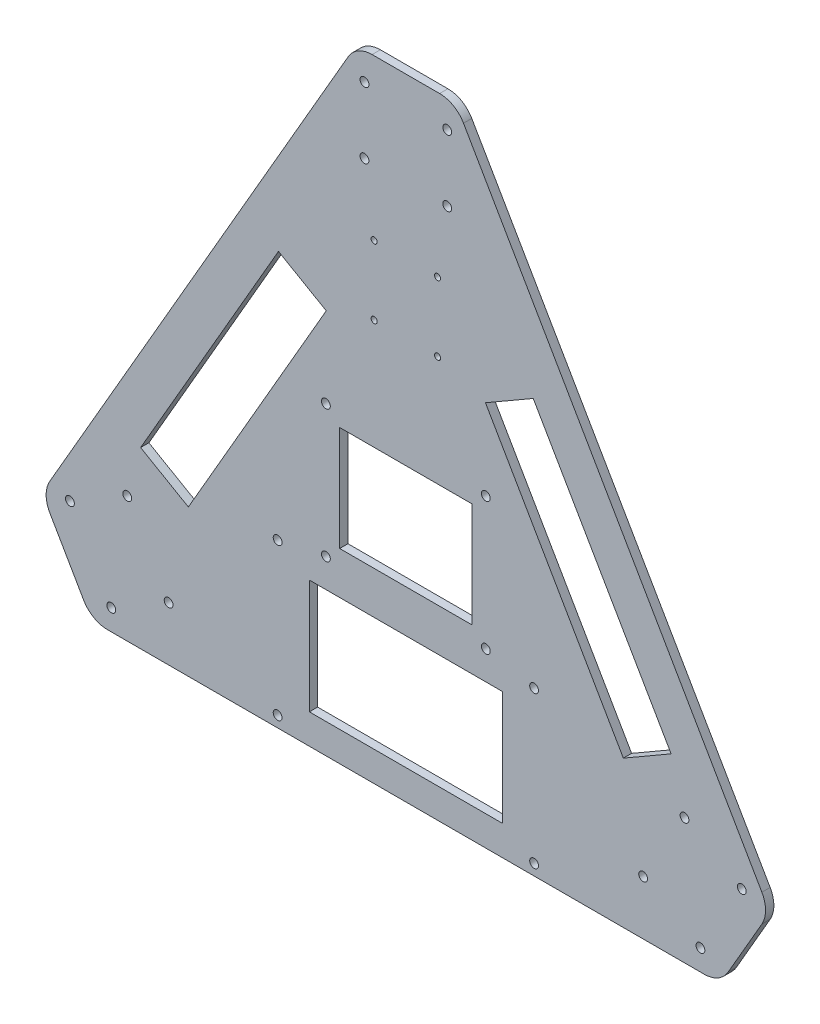
from build123d import *

# Parameters (mm, degrees)
SKETCH_1_R      = 1.6
SKETCH_1_R_2    = 1.1
SKETCH_1_W      = 48
SKETCH_1_H      = 38
SKETCH_1_W_2    = 70
SKETCH_1_H_2    = 41.397849463
EXTRUDE_1_DEPTH = 3
FILLET_1_R      = 10


with BuildPart() as part:
    # 草图1 → 凸台-拉伸1 (new body)
    with BuildSketch(Plane.XY):
        Polygon((-18.016261775, 142), (-131.983738225, -55.397459622), (-113.96747645, -86.602540378), (113.96747645, -86.602540378), (131.983738225, -55.397459622), (18.016261775, 142), align=None)
        with Locations((-15, 132)):
            Circle(SKETCH_1_R, mode=Mode.SUBTRACT)
        with Locations((15, 132)):
            Circle(SKETCH_1_R, mode=Mode.SUBTRACT)
        with Locations((15, 108)):
            Circle(SKETCH_1_R, mode=Mode.SUBTRACT)
        with Locations((-15, 108)):
            Circle(SKETCH_1_R, mode=Mode.SUBTRACT)
        with Locations((-29, 24)):
            Circle(SKETCH_1_R, mode=Mode.SUBTRACT)
        with Locations((-29, -24)):
            Circle(SKETCH_1_R, mode=Mode.SUBTRACT)
        with Locations((-86.030743609, -66.990381057)):
            Circle(SKETCH_1_R, mode=Mode.SUBTRACT)
        with Locations((29, -24)):
            Circle(SKETCH_1_R, mode=Mode.SUBTRACT)
        with Locations((29, 24)):
            Circle(SKETCH_1_R, mode=Mode.SUBTRACT)
        with Locations((101.030743609, -41.009618943)):
            Circle(SKETCH_1_R, mode=Mode.SUBTRACT)
        with Locations((86.030743609, -66.990381057)):
            Circle(SKETCH_1_R, mode=Mode.SUBTRACT)
        with Locations((106.8153533, -78.990381057)):
            Circle(SKETCH_1_R, mode=Mode.SUBTRACT)
        with Locations((121.8153533, -53.009618943)):
            Circle(SKETCH_1_R, mode=Mode.SUBTRACT)
        with Locations((-101.030743609, -41.009618943)):
            Circle(SKETCH_1_R, mode=Mode.SUBTRACT)
        with Locations((-121.8153533, -53.009618943)):
            Circle(SKETCH_1_R, mode=Mode.SUBTRACT)
        with Locations((-106.8153533, -78.990381057)):
            Circle(SKETCH_1_R, mode=Mode.SUBTRACT)
        with Locations((-11.5, 84)):
            Circle(SKETCH_1_R_2, mode=Mode.SUBTRACT)
        with Locations((11.5, 84)):
            Circle(SKETCH_1_R_2, mode=Mode.SUBTRACT)
        with Locations((11.5, 59)):
            Circle(SKETCH_1_R_2, mode=Mode.SUBTRACT)
        with Locations((-11.5, 59)):
            Circle(SKETCH_1_R_2, mode=Mode.SUBTRACT)
        with Locations((-46.5, -27.602540378)):
            Circle(SKETCH_1_R, mode=Mode.SUBTRACT)
        with Locations((-46.5, -82.602540378)):
            Circle(SKETCH_1_R, mode=Mode.SUBTRACT)
        with Locations((46.5, -82.602540378)):
            Circle(SKETCH_1_R, mode=Mode.SUBTRACT)
        with Locations((46.5, -27.602540378)):
            Circle(SKETCH_1_R, mode=Mode.SUBTRACT)
        Rectangle(SKETCH_1_W, SKETCH_1_H, mode=Mode.SUBTRACT)
        Polygon((-46.188021535, 63.205080757), (-28.867513459, 53.205080757), (-78.867513459, -33.397459622), (-96.188021535, -23.397459622), align=None, mode=Mode.SUBTRACT)
        with Locations((0, -55.102540379)):
            Rectangle(SKETCH_1_W_2, SKETCH_1_H_2, mode=Mode.SUBTRACT)
        Polygon((46.188021535, 63.205080757), (28.867513459, 53.205080757), (78.867513459, -33.397459622), (96.188021535, -23.397459622), align=None, mode=Mode.SUBTRACT)
    extrude(amount=EXTRUDE_1_DEPTH)

    # 圆角1
    fillet_1_edges = [part.edges().sort_by_distance(p)[0] for p in [
        (-131.983738225, -55.397459622, 1.5),
        (-18.016261775, 142, 1.5),
        (18.016261775, 142, 1.5),
        (131.983738225, -55.397459622, 1.5),
        (113.96747645, -86.602540378, 1.5),
        (-113.96747645, -86.602540378, 1.5),
    ]]
    fillet(fillet_1_edges, radius=FILLET_1_R)


solid = part.part
